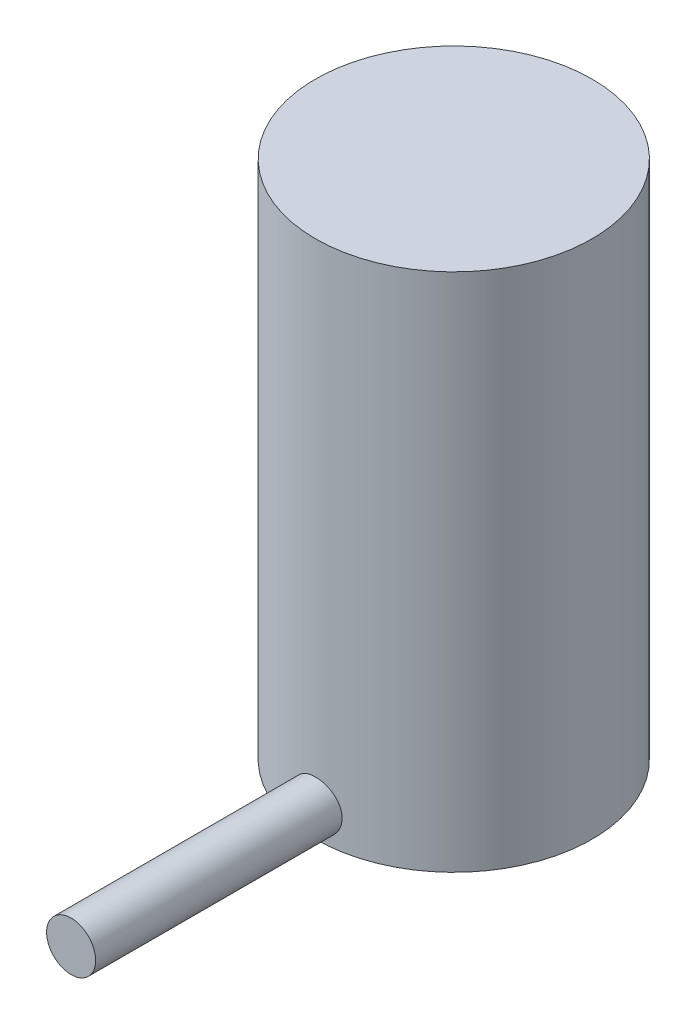
from build123d import *

# Parameters (mm, degrees)
SKETCH2_R           = 17.907
BOSS_EXTRUDE1_DEPTH = 69.85
SKETCH3_R           = 3.175
BOSS_EXTRUDE2_DEPTH = 49.53
SKETCH4_R           = 17.907
CUT_EXTRUDE1_DEPTH  = 2.54


with BuildPart() as part:
    # Sketch2 → Boss-Extrude1 (new body)
    with BuildSketch(Plane(origin=(0, 0, 0), x_dir=(1, 0, 0), z_dir=(0, 1, 0))):
        with Locations(Location((0, 0, 0), (0, 0, 270))):
            Circle(SKETCH2_R)
    extrude(amount=BOSS_EXTRUDE1_DEPTH)

    # Sketch3 → Boss-Extrude2 (add)
    with BuildSketch(Plane.XY):
        with Locations(Location((0, 6.35, 0), (0, 0, 180))):
            Circle(SKETCH3_R)
    extrude(amount=BOSS_EXTRUDE2_DEPTH)

    # Sketch4 → Cut-Extrude1 (cut)
    with BuildSketch(Plane.XZ):
        with Locations(Location((0, 0, 0), (0, 0, 270))):
            Circle(SKETCH4_R)
    extrude(amount=-CUT_EXTRUDE1_DEPTH, mode=Mode.SUBTRACT)


solid = part.part
